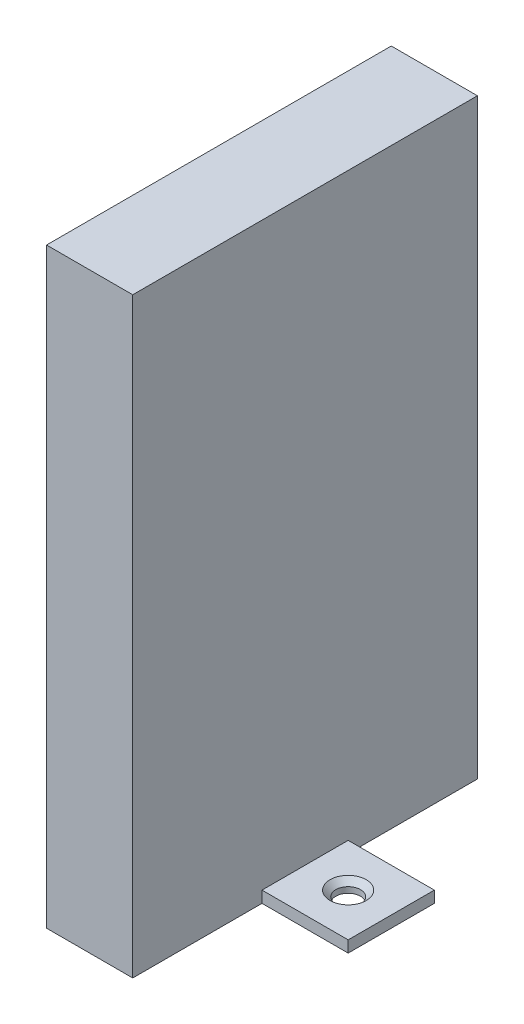
from build123d import *

# Parameters (mm, degrees)
SKETCH1_W           = 15
SKETCH1_H           = 60
BOSS_EXTRUDE1_DEPTH = 103
SKETCH2_W           = 15
SKETCH2_H           = 2
BOSS_EXTRUDE2_DEPTH = 15
SKETCH3_W           = 15
SKETCH3_H           = 2
BOSS_EXTRUDE3_DEPTH = 15
SKETCH4_R           = 2.15
CUT_EXTRUDE1_DEPTH  = 15
CHAMFER2_SIZE       = 1


with BuildPart() as part:
    # Sketch1 → Boss-Extrude1 (new body)
    with BuildSketch(Plane(origin=(0, 0, 0), x_dir=(1, 0, 0), z_dir=(0, 1, 0))):
        with Locations((7.5, 30)):
            Rectangle(SKETCH1_W, SKETCH1_H)
    extrude(amount=BOSS_EXTRUDE1_DEPTH)

    # Sketch2 → Boss-Extrude2 (add)
    with BuildSketch(Plane(origin=(15, 0, 0), x_dir=(0, 0, -1), z_dir=(1, 0, 0))):
        with Locations((30, 1)):
            Rectangle(SKETCH2_W, SKETCH2_H)
    extrude(amount=BOSS_EXTRUDE2_DEPTH)

    # Sketch3 → Boss-Extrude3 (add)
    with BuildSketch(Plane.ZY):
        with Locations((-30, 1)):
            Rectangle(SKETCH3_W, SKETCH3_H)
    extrude(amount=BOSS_EXTRUDE3_DEPTH)

    # Sketch4 → Cut-Extrude1 (cut)
    with BuildSketch(Plane(origin=(0, 2, 0), x_dir=(1, 0, 0), z_dir=(0, 1, 0))):
        with Locations(Location((22.5, 30, 0), (0, 0, 270))):
            Circle(SKETCH4_R)
        with Locations(Location((-7.5, 30, 0), (0, 0, 270))):
            Circle(SKETCH4_R)
    extrude(amount=-CUT_EXTRUDE1_DEPTH, mode=Mode.SUBTRACT)

    # Chamfer2
    chamfer2_edges = [part.edges().sort_by_distance(p)[0] for p in [
        (22.5, 2, -32.15),
        (-7.5, 2, -32.15),
    ]]
    chamfer(chamfer2_edges, length=CHAMFER2_SIZE)


solid = part.part
